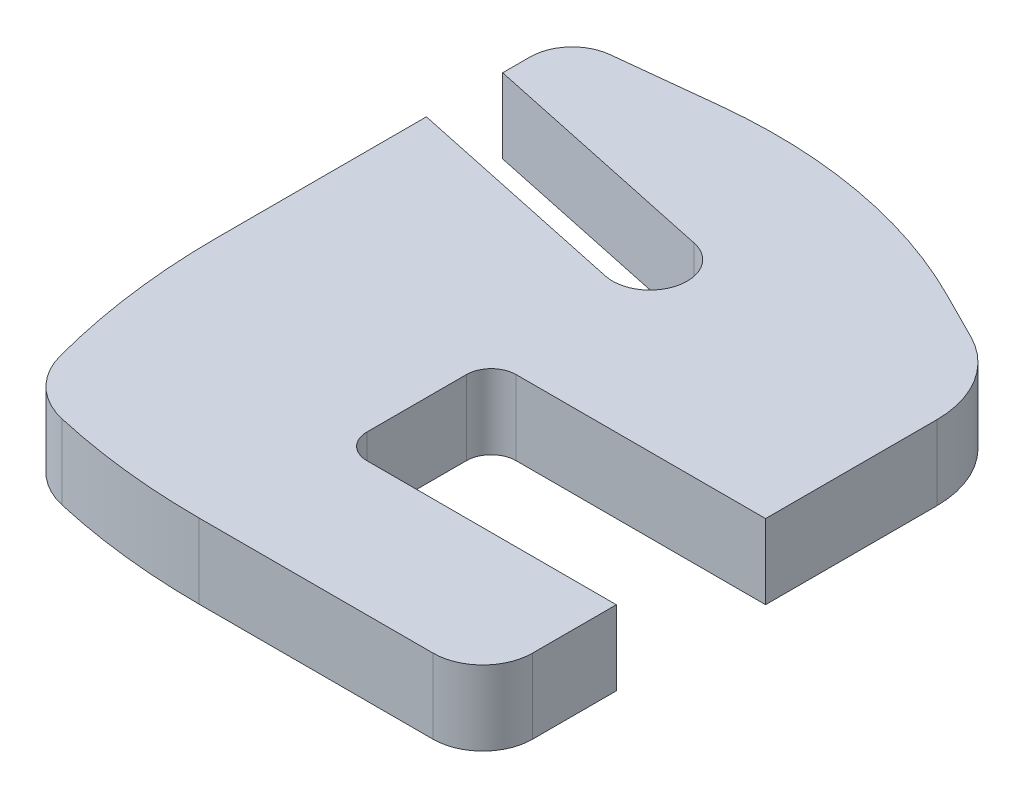
from build123d import *

# Parameters (mm, degrees)
BOSS_EXTRUDE1_DEPTH = 3


with BuildPart() as part:
    # Sketch1 → Boss-Extrude1 (new body)
    with BuildSketch(Plane(origin=(0, 0, 0), x_dir=(1, 0, 0), z_dir=(0, 1, 0))):
        with BuildLine():
            Line((0, 6), (0, 12.885607037))
            ThreePointArc((0, 12.885607037), (-0.594451952, 14.983759198), (-2.201121246, 16.458286036))
            Line((-2.201121246, 16.458286036), (-4.154505591, 17.441834123))
            ThreePointArc((-4.154505591, 17.441834123), (-9.586112213, 19.258544509), (-15.309892207, 19.461349126))
            Line((-15.309892207, 19.461349126), (-19.293684392, 19.028366911))
            ThreePointArc((-19.293684392, 19.028366911), (-20.375358342, 18.473602904), (-20.81, 17.338319562))
            Line((-20.81, 17.338319562), (-20.81, 16.238803173))
            Line((-20.81, 16.238803173), (-11.03, 14.16))
            ThreePointArc((-11.03, 14.16), (-9.874646135, 12.380911063), (-11.653735072, 11.225557198))
            Line((-11.653735072, 11.225557198), (-20.81, 13.171781389))
            Line((-20.81, 13.171781389), (-20.81, 4.766752866))
            ThreePointArc((-20.81, 4.766752866), (-20.567080075, 1.086466776), (-19.842535307, -2.529961112))
            ThreePointArc((-19.842535307, -2.529961112), (-19.024517018, -3.911631932), (-17.611135307, -4.673550768))
            ThreePointArc((-17.611135307, -4.673550768), (-14.527545315, -5.195342958), (-11.405, -5.37))
            Line((-11.405, -5.37), (-2, -5.37))
            ThreePointArc((-2, -5.37), (-0.585786438, -4.784213562), (0, -3.37))
            Line((0, -3.37), (0, 0))
            Line((0, 0), (-10.03, 0))
            ThreePointArc((-10.03, 0), (-10.737106781, 0.292893219), (-11.03, 1))
            Line((-11.03, 1), (-11.03, 5))
            ThreePointArc((-11.03, 5), (-10.737106781, 5.707106781), (-10.03, 6))
            Line((-10.03, 6), (0, 6))
        make_face()
    extrude(amount=BOSS_EXTRUDE1_DEPTH)


solid = part.part
